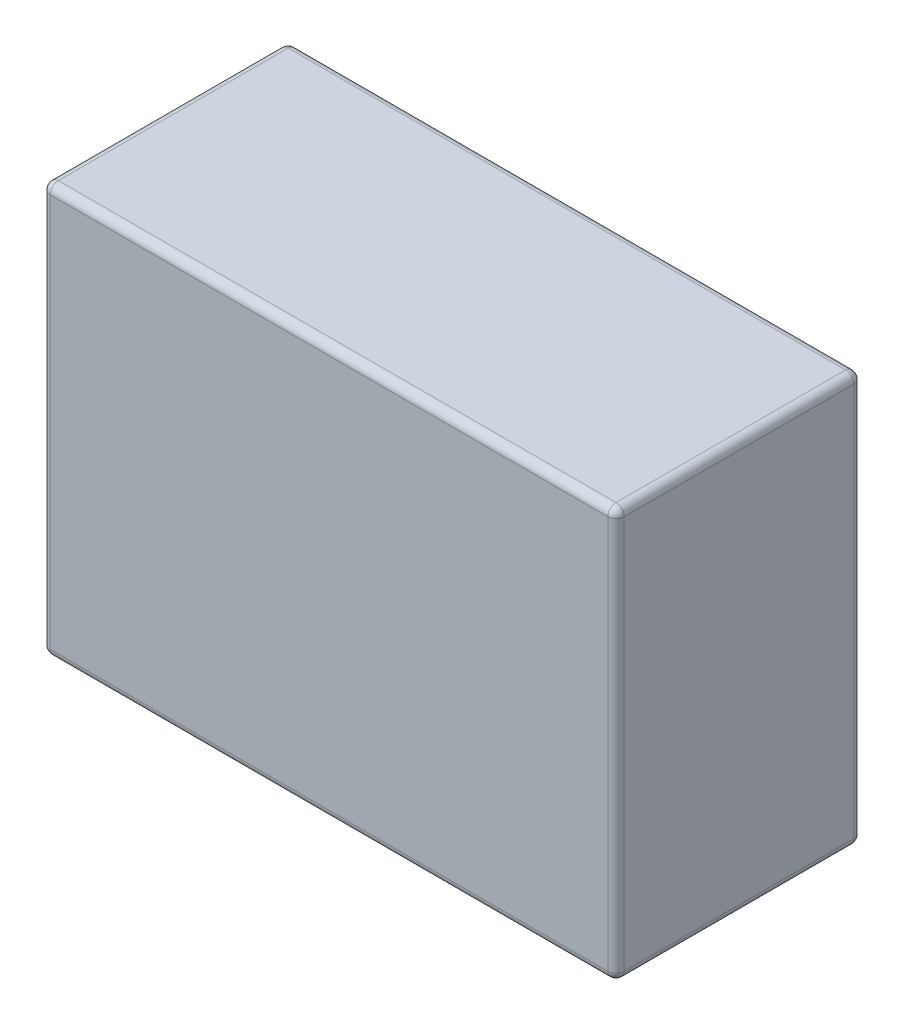
from build123d import *

# Parameters (mm, degrees)
SKETCH_1_W          = 700
SKETCH_1_H          = 300
EXTRUDE_1_DEPTH     = 500
FILLET_1_R          = 10
SKETCH_2_W          = 650.999625187
SKETCH_2_H          = 106.196586902
SKETCH_2_H_2        = 130.199925037
CUT_EXTRUDE_1_DEPTH = 280


with BuildPart() as part:
    # 草图1 → 凸台-拉伸1 (new body)
    with BuildSketch(Plane(origin=(0, 0, 0), x_dir=(1, 0, 0), z_dir=(0, 1, 0))):
        Rectangle(SKETCH_1_W, SKETCH_1_H)
    extrude(amount=EXTRUDE_1_DEPTH)

    # 圆角1
    fillet_1_edges = [part.edges().sort_by_distance(p)[0] for p in [
        (350, 500, 0),
        (0, 500, -150),
        (-350, 500, 0),
        (0, 0, -150),
        (350, 0, 0),
        (0, 0, 150),
        (-350, 0, 0),
        (0, 500, 150),
        (-350, 250, -150),
        (350, 250, -150),
        (350, 250, 150),
        (-350, 250, 150),
    ]]
    fillet(fillet_1_edges, radius=FILLET_1_R)

    # 草图2 → 切除-拉伸1 (cut)
    with BuildSketch(Plane(origin=(0, 0, -150), x_dir=(-1, 0, 0), z_dir=(0, 0, -1))):
        with Locations((2.909495531, 414.750184475)):
            Rectangle(SKETCH_2_W, SKETCH_2_H)
        with Locations((2.909495531, 185.263724423)):
            Rectangle(SKETCH_2_W, SKETCH_2_H_2)
    extrude(amount=-CUT_EXTRUDE_1_DEPTH, mode=Mode.SUBTRACT)


solid = part.part
